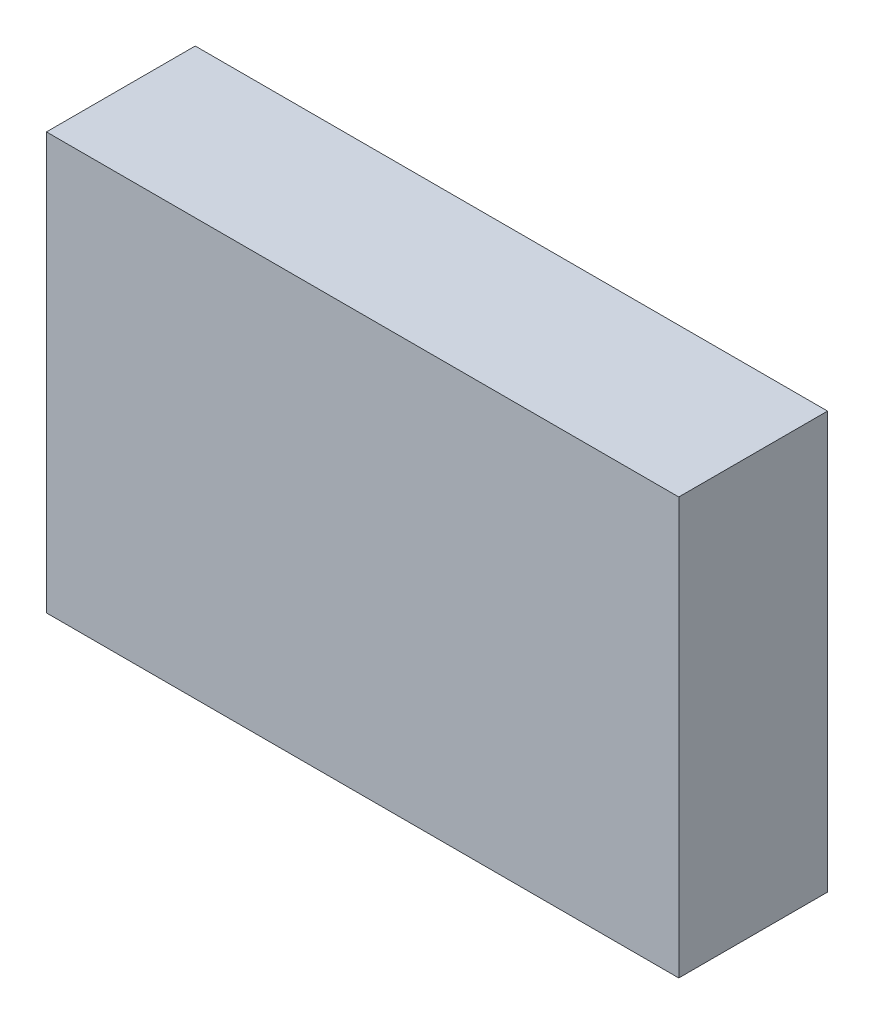
from build123d import *

# Parameters (mm, degrees)
SKETCH1_W           = 85
SKETCH1_H           = 56
BOSS_EXTRUDE1_DEPTH = 20


with BuildPart() as part:
    # Sketch1 → Boss-Extrude1 (new body)
    with BuildSketch(Plane.XY):
        with Locations((42.5, -28)):
            Rectangle(SKETCH1_W, SKETCH1_H)
    extrude(amount=BOSS_EXTRUDE1_DEPTH)


solid = part.part
